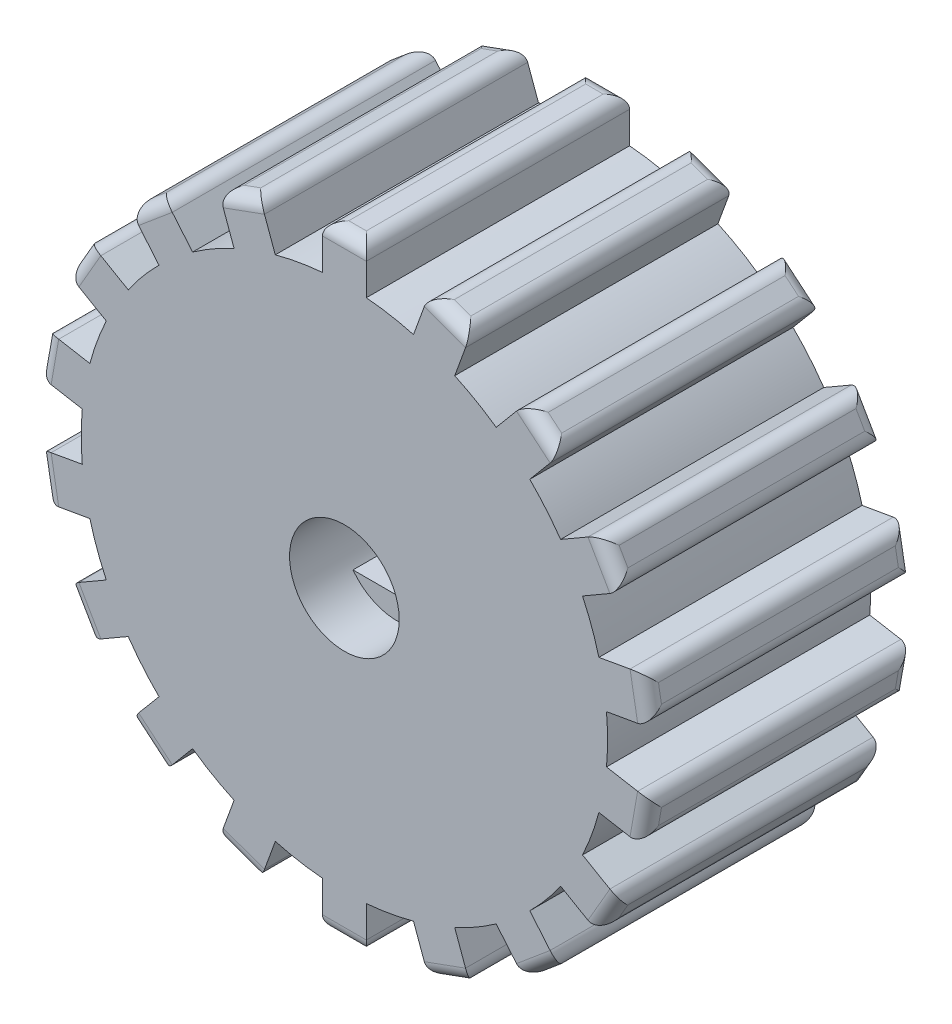
from build123d import *
from build123d.topology import SkipClean

# Parameters (mm, degrees)
SKETCH2_R                = 60
BOSS_EXTRUDE1_DEPTH      = 60
SKETCH3_W                = 10
SKETCH3_H                = 10.47851478
BOSS_EXTRUDE2_DEPTH      = 60
FILLET2_R                = 3
CIRPATTERN1_COUNT        = 18
FILLET2_OF_CIRPATTERN1_R = 3
SKETCH4_R                = 10
CUT_EXTRUDE1_DEPTH       = 60
SKETCH5_R                = 22.481820488
BOSS_EXTRUDE3_DEPTH      = 60
SKETCH6_R                = 12.5
CUT_EXTRUDE2_DEPTH       = 12
CUT_EXTRUDE3_DEPTH       = 30.5
SCALE1_SCALE             = 0.2


with BuildPart() as part:
    # Sketch2 → Boss-Extrude1 (new body)
    with BuildSketch(Plane.XY):
        Circle(SKETCH2_R)
    extrude(amount=BOSS_EXTRUDE1_DEPTH)

    # Sketch3 → Boss-Extrude2 (add)
    with BuildSketch(Plane.XY.offset(60)):
        with Locations((0, 64.76074261)):
            Rectangle(SKETCH3_W, SKETCH3_H)
    boss_extrude2 = extrude(amount=-BOSS_EXTRUDE2_DEPTH)

    # Fillet2
    fillet2_edges = [part.edges().sort_by_distance(p)[0] for p in [
        (5, 70, 30),
        (0, 70, 0),
        (-5, 70, 30),
        (0, 70, 60),
    ]]
    fillet(fillet2_edges, radius=FILLET2_R)

    # CirPattern1: Boss-Extrude2 ×18 about axis
    cirpattern1_axis = Axis((0, 0, 0), (0, 0, 1))
    for i in range(1, CIRPATTERN1_COUNT):
        add(boss_extrude2.rotate(cirpattern1_axis, i * 360 / CIRPATTERN1_COUNT))

    # Fillet2 of CirPattern1
    fillet2_of_cirpattern1_edges = [part.edges().sort_by_distance(p)[0] for p in [
        (-19.242946929, 67.488584172, 30),
        (-23.941410033, 65.778483455, 0),
        (-28.639873137, 64.068382738, 30),
        (-23.941410033, 65.778483455, 60),
        (-41.164910462, 56.837049067, 30),
        (-44.995132678, 53.623111018, 0),
        (-48.825354894, 50.40917297, 30),
        (-44.995132678, 53.623111018, 60),
        (-58.121778265, 39.330127019, 30),
        (-60.621778265, 35, 0),
        (-63.121778265, 30.669872981, 30),
        (-60.621778265, 35, 60),
        (-68.068301823, 17.079411202, 30),
        (-68.936542711, 12.155372437, 0),
        (-69.804783599, 7.231333672, 30),
        (-68.936542711, 12.155372437, 60),
        (-69.804783599, -7.231333672, 30),
        (-68.936542711, -12.155372437, 0),
        (-68.068301823, -17.079411202, 30),
        (-68.936542711, -12.155372437, 60),
        (-63.121778265, -30.669872981, 30),
        (-60.621778265, -35, 0),
        (-58.121778265, -39.330127019, 30),
        (-60.621778265, -35, 60),
        (-48.825354894, -50.40917297, 30),
        (-44.995132678, -53.623111018, 0),
        (-41.164910462, -56.837049067, 30),
        (-44.995132678, -53.623111018, 60),
        (-28.639873137, -64.068382738, 30),
        (-23.941410033, -65.778483455, 0),
        (-19.242946929, -67.488584172, 30),
        (-23.941410033, -65.778483455, 60),
        (-5, -70, 30),
        (0, -70, 0),
        (5, -70, 30),
        (0, -70, 60),
        (19.242946929, -67.488584172, 30),
        (23.941410033, -65.778483455, 0),
        (28.639873137, -64.068382738, 30),
        (23.941410033, -65.778483455, 60),
        (41.164910462, -56.837049067, 30),
        (44.995132678, -53.623111018, 0),
        (48.825354894, -50.40917297, 30),
        (44.995132678, -53.623111018, 60),
        (58.121778265, -39.330127019, 30),
        (60.621778265, -35, 0),
        (63.121778265, -30.669872981, 30),
        (60.621778265, -35, 60),
        (68.068301823, -17.079411202, 30),
        (68.936542711, -12.155372437, 0),
        (69.804783599, -7.231333672, 30),
        (68.936542711, -12.155372437, 60),
        (69.804783599, 7.231333672, 30),
        (68.936542711, 12.155372437, 0),
        (68.068301823, 17.079411202, 30),
        (68.936542711, 12.155372437, 60),
        (63.121778265, 30.669872981, 30),
        (60.621778265, 35, 0),
        (58.121778265, 39.330127019, 30),
        (60.621778265, 35, 60),
        (48.825354894, 50.40917297, 30),
        (44.995132678, 53.623111018, 0),
        (41.164910462, 56.837049067, 30),
        (44.995132678, 53.623111018, 60),
        (28.639873137, 64.068382738, 30),
        (23.941410033, 65.778483455, 0),
        (19.242946929, 67.488584172, 30),
        (23.941410033, 65.778483455, 60),
    ]]
    fillet(fillet2_of_cirpattern1_edges, radius=FILLET2_OF_CIRPATTERN1_R)

    # Sketch4 → Cut-Extrude1 (cut)
    with BuildSketch(Plane.XY.offset(60)):
        Circle(SKETCH4_R)
    extrude(amount=-CUT_EXTRUDE1_DEPTH, mode=Mode.SUBTRACT)

    # Sketch5 → Boss-Extrude3 (add)
    with BuildSketch(Plane.XY.offset(60)):
        Circle(SKETCH5_R)
    extrude(amount=-BOSS_EXTRUDE3_DEPTH)

    # Sketch6 → Cut-Extrude2 (cut)
    with BuildSketch(Plane.XY.offset(60)):
        Circle(SKETCH6_R)
    extrude(amount=-CUT_EXTRUDE2_DEPTH, mode=Mode.SUBTRACT)

    # Sketch7 → Cut-Extrude3 (cut)
    with SkipClean():  # the faces are left unmerged after this step: merging them gives an invalid solid
        with BuildSketch(Plane.XY.offset(48)):
            with BuildLine():
                Line((10.037305415, -7.45), (-10.037305415, -7.45))
                ThreePointArc((-10.037305415, -7.45), (-12.5, 0), (-10.037305415, 7.45))
                Line((-10.037305415, 7.45), (10.037305415, 7.45))
                ThreePointArc((10.037305415, 7.45), (12.5, 0), (10.037305415, -7.45))
            make_face()
        extrude(amount=-CUT_EXTRUDE3_DEPTH, mode=Mode.SUBTRACT)


with BuildPart() as part_1:
    # Scale1: scaled about (3e-09, 1e-09, 29.777250978)
    add(part.part.scale(SCALE1_SCALE).moved(Location((2e-09, 1e-09, 23.821800782))))


solid = part_1.part
